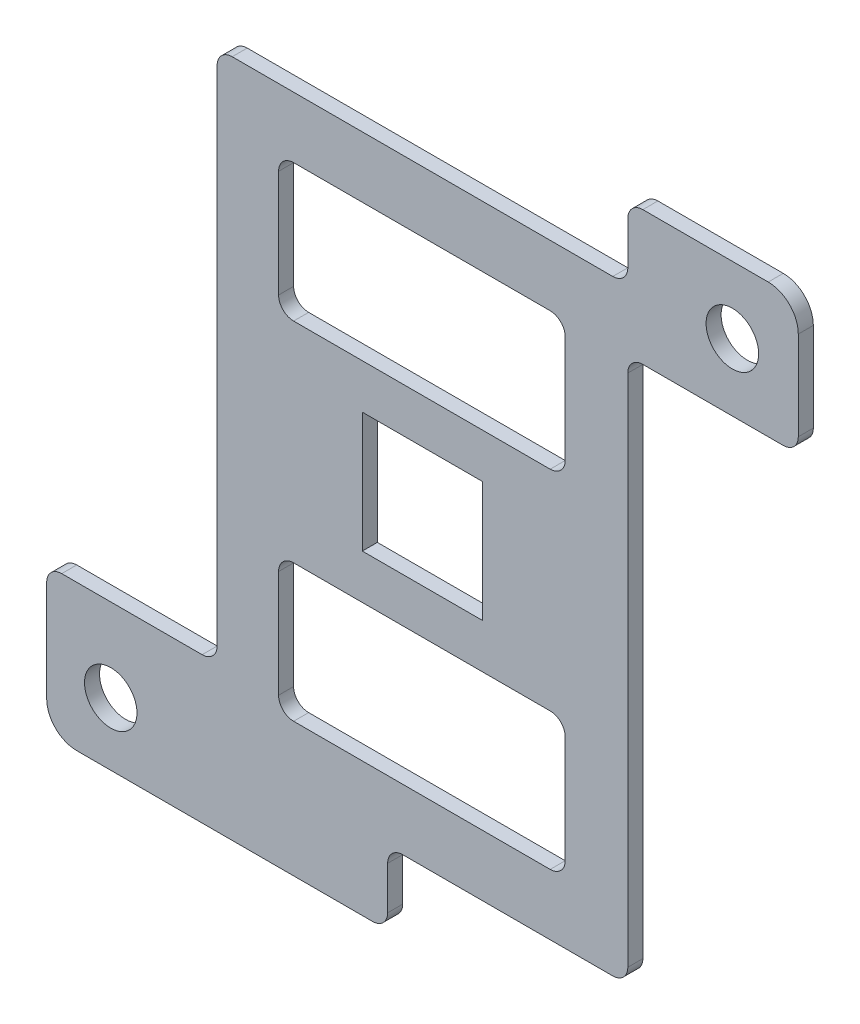
from build123d import *

# Parameters (mm, degrees)
ESQUISSE1_R        = 1.745730463
ESQUISSE1_R_2      = 1.75
ESQUISSE1_W        = 8.004851144
ESQUISSE1_H        = 8.004851144
BOSS_EXTRU_1_DEPTH = 1


with BuildPart() as part:
    # Esquisse1 → Boss.-Extru.1 (new body)
    with BuildSketch(Plane.XY):
        with BuildLine():
            Line((-122.090539275, -67.2444), (-98.063455394, -67.2444))
            Line((-98.063455394, -67.2444), (-96.772260725, -67.2444))
            ThreePointArc((-96.772260725, -67.2444), (-96.065153944, -66.951506781), (-95.772260725, -66.2444))
            Line((-95.772260725, -66.2444), (-95.772260725, -63.394))
            ThreePointArc((-95.772260725, -63.394), (-95.479367507, -62.686893219), (-94.772260725, -62.394))
            Line((-94.772260725, -62.394), (-86.4314, -62.394))
            ThreePointArc((-86.4314, -62.394), (-85.017186438, -62.979786438), (-84.4314, -64.394))
            Line((-84.4314, -64.394), (-84.4314, -70.310741156))
            ThreePointArc((-84.4314, -70.310741156), (-84.724293219, -71.017847937), (-85.4314, -71.310741156))
            Line((-85.4314, -71.310741156), (-94.772260725, -71.310741156))
            ThreePointArc((-94.772260725, -71.310741156), (-95.479367507, -71.603634375), (-95.772260725, -72.310741156))
            Line((-95.772260725, -72.310741156), (-95.772260725, -106.5436))
            ThreePointArc((-95.772260725, -106.5436), (-96.065153944, -107.250706781), (-96.772260725, -107.5436))
            Line((-96.772260725, -107.5436), (-110.749678549, -107.5436))
            ThreePointArc((-110.749678549, -107.5436), (-111.45678533, -107.836493219), (-111.749678549, -108.5436))
            Line((-111.749678549, -108.5436), (-111.749678549, -111.394))
            ThreePointArc((-111.749678549, -111.394), (-112.042571768, -112.101106781), (-112.749678549, -112.394))
            Line((-112.749678549, -112.394), (-132.4314, -112.394))
            ThreePointArc((-132.4314, -112.394), (-133.845613562, -111.808213562), (-134.4314, -110.394))
            Line((-134.4314, -110.394), (-134.4314, -103.6932))
            ThreePointArc((-134.4314, -103.6932), (-134.138506781, -102.986093219), (-133.4314, -102.6932))
            Line((-133.4314, -102.6932), (-124.090539275, -102.6932))
            ThreePointArc((-124.090539275, -102.6932), (-123.383432493, -102.400306781), (-123.090539275, -101.6932))
            Line((-123.090539275, -101.6932), (-123.090539275, -68.2444))
            ThreePointArc((-123.090539275, -68.2444), (-122.797646056, -67.537293219), (-122.090539275, -67.2444))
        make_face()
        with Locations((-130.170361884, -108.219670908)):
            Circle(ESQUISSE1_R, mode=Mode.SUBTRACT)
        with Locations((-88.817, -66.847)):
            Circle(ESQUISSE1_R_2, mode=Mode.SUBTRACT)
        with Locations((-109.4314, -87.394)):
            Rectangle(ESQUISSE1_W, ESQUISSE1_H, mode=Mode.SUBTRACT)
        with BuildLine():
            Line((-118.004092872, -71.30163173), (-100.936518074, -71.30163173))
            ThreePointArc((-100.936518074, -71.30163173), (-100.229411293, -71.594524949), (-99.936518074, -72.30163173))
            Line((-99.936518074, -72.30163173), (-99.936518074, -79.429611883))
            ThreePointArc((-99.936518074, -79.429611883), (-100.229411293, -80.136718664), (-100.936518074, -80.429611883))
            Line((-100.936518074, -80.429611883), (-118.004092872, -80.429611883))
            ThreePointArc((-118.004092872, -80.429611883), (-118.711199653, -80.136718664), (-119.004092872, -79.429611883))
            Line((-119.004092872, -79.429611883), (-119.004092872, -72.30163173))
            ThreePointArc((-119.004092872, -72.30163173), (-118.711199653, -71.594524949), (-118.004092872, -71.30163173))
        make_face(mode=Mode.SUBTRACT)
        with BuildLine():
            Line((-118.004092872, -103.48636827), (-100.936518074, -103.48636827))
            ThreePointArc((-100.936518074, -103.48636827), (-100.229411293, -103.193475051), (-99.936518074, -102.48636827))
            Line((-99.936518074, -102.48636827), (-99.936518074, -95.358388117))
            ThreePointArc((-99.936518074, -95.358388117), (-100.229411293, -94.651281336), (-100.936518074, -94.358388117))
            Line((-100.936518074, -94.358388117), (-118.004092872, -94.358388117))
            ThreePointArc((-118.004092872, -94.358388117), (-118.711199653, -94.651281336), (-119.004092872, -95.358388117))
            Line((-119.004092872, -95.358388117), (-119.004092872, -102.48636827))
            ThreePointArc((-119.004092872, -102.48636827), (-118.711199653, -103.193475051), (-118.004092872, -103.48636827))
        make_face(mode=Mode.SUBTRACT)
    extrude(amount=BOSS_EXTRU_1_DEPTH)


solid = part.part
